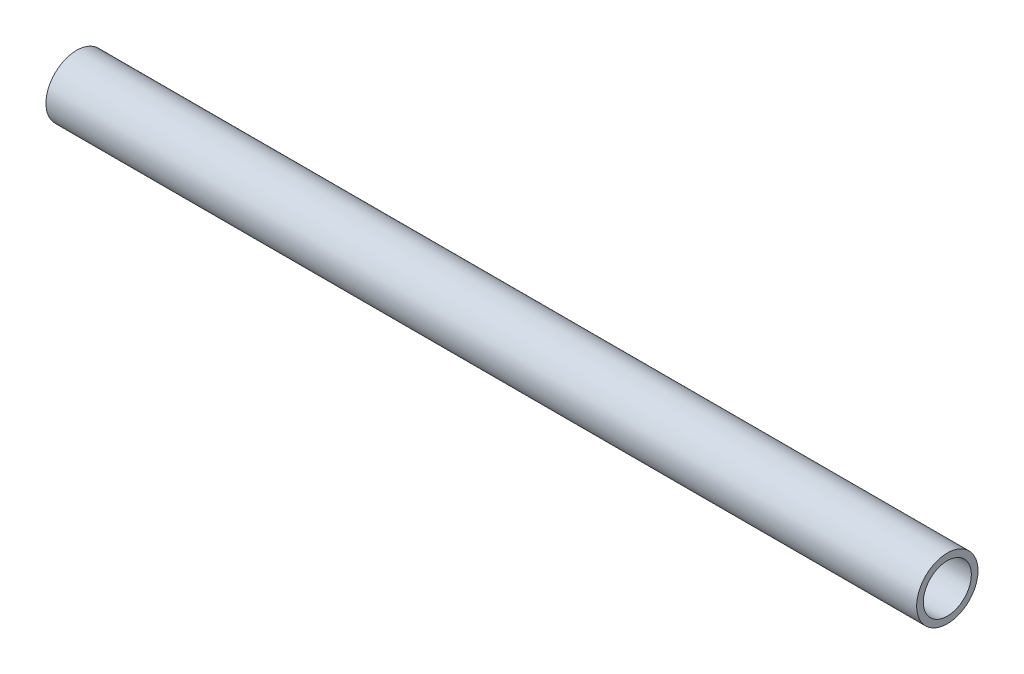
from build123d import *

# Parameters (mm, degrees)
SKETCH1_R           = 13.35
SKETCH1_R_2         = 10.45
BOSS_EXTRUDE1_DEPTH = 378.9


with BuildPart() as part:
    # Sketch1 → Boss-Extrude1 (new body)
    with BuildSketch(Plane(origin=(0, 0, 0), x_dir=(0, 0, -1), z_dir=(1, 0, 0))):
        Circle(SKETCH1_R)
        Circle(SKETCH1_R_2, mode=Mode.SUBTRACT)
    extrude(amount=BOSS_EXTRUDE1_DEPTH)


solid = part.part
